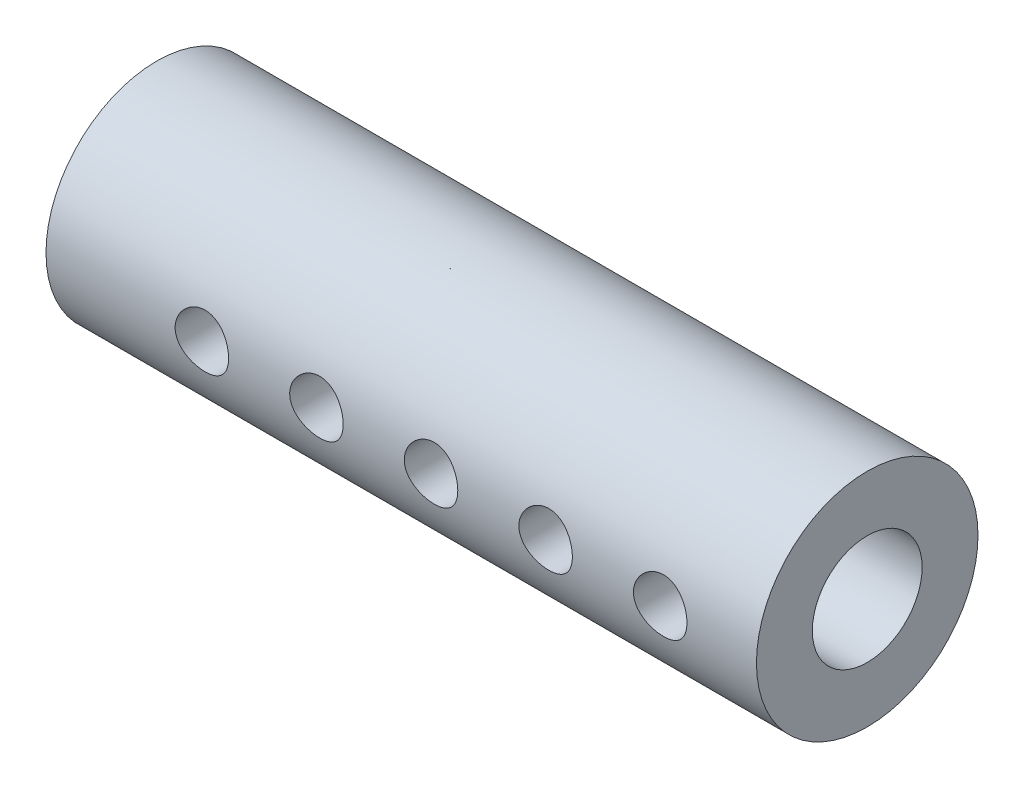
from build123d import *

# Parameters (mm, degrees)
SKETCH1_R               = 18.415
BOSS_EXTRUDE1_DEPTH     = 118.11
SKETCH2_R               = 9.128125
CUT_EXTRUDE1_DEPTH      = 118.11
CUT_EXTRUDE2_REACH      = 127.082
CUT_EXTRUDE2_END_RADIUS = 9.128125
SKETCH4_R               = 4.445
LPATTERN1_COUNT         = 5
LPATTERN1_PITCH         = 19.05


with BuildPart() as part:
    # Sketch1 → Boss-Extrude1 (new body)
    with BuildSketch(Plane(origin=(0, 0, 0), x_dir=(0, 0, -1), z_dir=(1, 0, 0))):
        Circle(SKETCH1_R)
    extrude(amount=BOSS_EXTRUDE1_DEPTH)

    # Sketch2 → Cut-Extrude1 (cut)
    with BuildSketch(Plane.ZY):
        Circle(SKETCH2_R)
    extrude(amount=-CUT_EXTRUDE1_DEPTH, mode=Mode.SUBTRACT)

    # Cut-Extrude2: up to this cylinder (the profile starts outside it)
    cut_extrude2_end = Plane(origin=(25.908, 0, 0), z_dir=(-1, 0, 0)) * Cylinder(CUT_EXTRUDE2_END_RADIUS, 273.42025, mode=Mode.PRIVATE)
    # Sketch4 → Cut-Extrude2 (cut, up to the surface)
    with BuildSketch(Plane.XY.offset(18.415), mode=Mode.PRIVATE) as cut_extrude2_sk1:
        with Locations((25.908, 0)):
            Circle(SKETCH4_R)
    cut_extrude2_tool1 = extrude(cut_extrude2_sk1.sketch, amount=-CUT_EXTRUDE2_REACH, mode=Mode.PRIVATE) - cut_extrude2_end
    cut_extrude2 = cut_extrude2_tool1.solids().sort_by_distance((25.908, 0, 18.415))[0]
    add(cut_extrude2, mode=Mode.SUBTRACT)

    # LPattern1: Cut-Extrude2 ×5
    with Locations(*[(i * LPATTERN1_PITCH, 0, 0) for i in range(1, LPATTERN1_COUNT)]):
        add(cut_extrude2, mode=Mode.SUBTRACT)


solid = part.part
